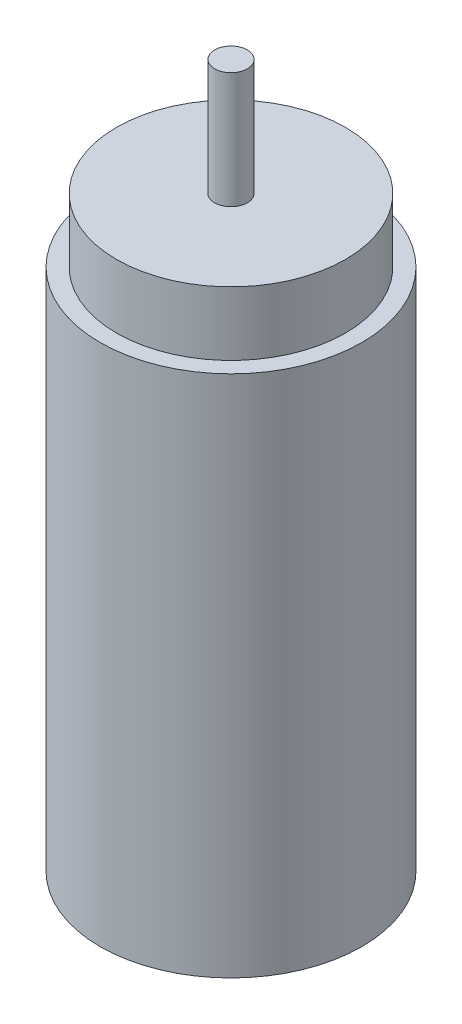
from build123d import *

# Parameters (mm, degrees)
SKETCH1_R           = 4
BOSS_EXTRUDE1_DEPTH = 16
SKETCH2_R           = 3.5
BOSS_EXTRUDE2_DEPTH = 1.95
SKETCH4_R           = 0.5
BOSS_EXTRUDE3_DEPTH = 5.5


with BuildPart() as part:
    # Sketch1 → Boss-Extrude1 (new body)
    with BuildSketch(Plane(origin=(0, 0, 0), x_dir=(1, 0, 0), z_dir=(0, 1, 0))):
        with Locations(Location((0, 0, 0), (0, 0, 270))):
            Circle(SKETCH1_R)
    extrude(amount=BOSS_EXTRUDE1_DEPTH)

    # Sketch2 → Boss-Extrude2 (add)
    with BuildSketch(Plane(origin=(0, 16, 0), x_dir=(1, 0, 0), z_dir=(0, 1, 0))):
        with Locations(Location((0, 0, 0), (0, 0, 270))):
            Circle(SKETCH2_R)
    extrude(amount=BOSS_EXTRUDE2_DEPTH)

    # Sketch4 → Boss-Extrude3 (add)
    with BuildSketch(Plane(origin=(0, 16, 0), x_dir=(1, 0, 0), z_dir=(0, 1, 0))):
        with Locations(Location((0, 0, 0), (0, 0, 270))):
            Circle(SKETCH4_R)
    extrude(amount=BOSS_EXTRUDE3_DEPTH)


solid = part.part
